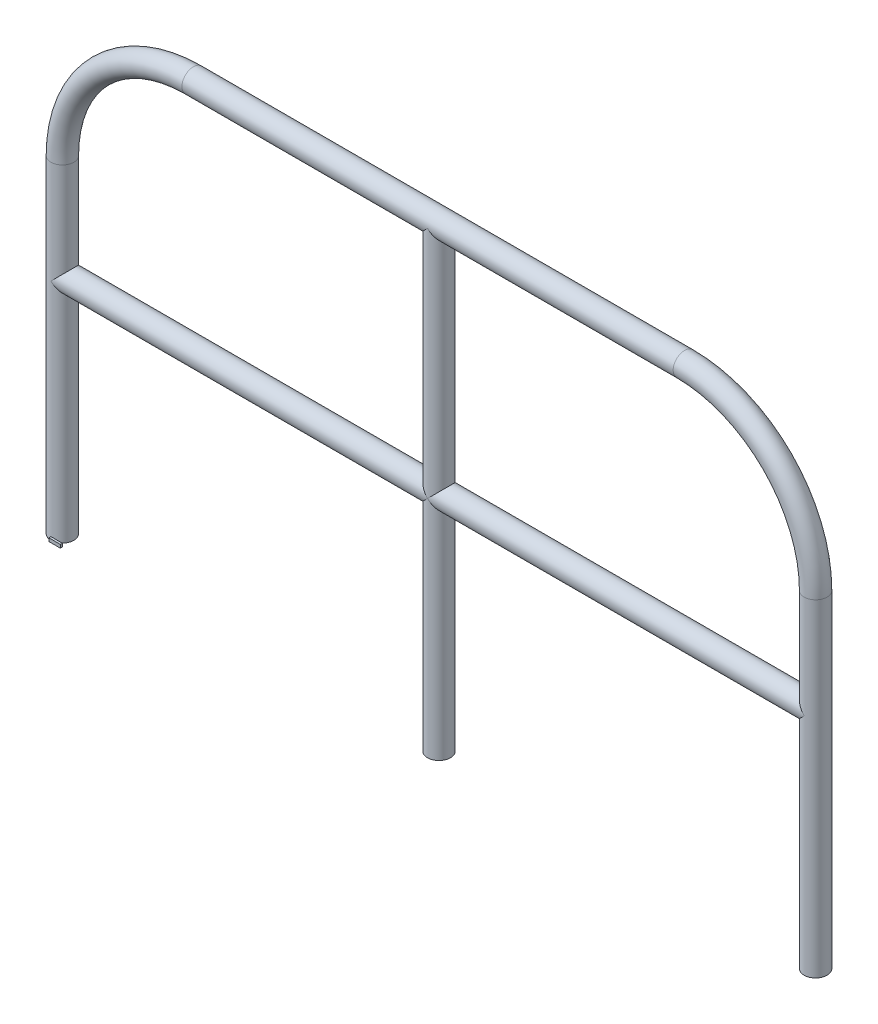
from build123d import *

# Parameters (mm, degrees)
SKETCH_4_R      = 35
SKETCH_8_R      = 35
EXTRUDE_6_DEPTH = 1400
SKETCH_9_R      = 35
EXTRUDE_7_DEPTH = 2300
SKETCH_10_W     = 35
SKETCH_10_H     = 6.222529257
EXTRUDE_8_DEPTH = 10


with BuildPart() as part:
    # 扫描2: sweep along a path in 草图3
    with BuildLine(Plane.XY) as sweep_2_path:
        Line((0, 0), (0, 1000))
        ThreePointArc((0, 1000), (117.157287525, 1282.842712475), (400, 1400))
        Line((400, 1400), (1900, 1400))
        ThreePointArc((1900, 1400), (2182.842712475, 1282.842712475), (2300, 1000))
        Line((2300, 1000), (2300, 0))
    # 草图4 → 扫描2 (sweep)
    with BuildSketch(Plane(origin=(0, 0, 0), x_dir=(1, 0, 0), z_dir=(0, 1, 0))):
        Circle(SKETCH_4_R)
    sweep(path=sweep_2_path.line)

    # 草图8 → 凸台-拉伸6 (add)
    with BuildSketch(Plane.XZ):
        with Locations(Location((1150, 0, 0), (0, 0, 270))):
            Circle(SKETCH_8_R)
    extrude(amount=-EXTRUDE_6_DEPTH)

    # 草图9 → 凸台-拉伸7 (add)
    with BuildSketch(Plane(origin=(0, 0, 0), x_dir=(0, 0, -1), z_dir=(1, 0, 0))):
        with Locations(Location((0, 685.754772245, 0), (0, 0, 180))):
            Circle(SKETCH_9_R)
    extrude(amount=EXTRUDE_7_DEPTH)


with BuildPart() as body_2:
    # 草图10 → 凸台-拉伸8 (new body)
    with BuildSketch(Plane.XZ):
        with Locations((17.5, 38.111264629)):
            Rectangle(SKETCH_10_W, SKETCH_10_H)
    extrude(amount=-EXTRUDE_8_DEPTH)


solid = Compound([part.part, body_2.part])
